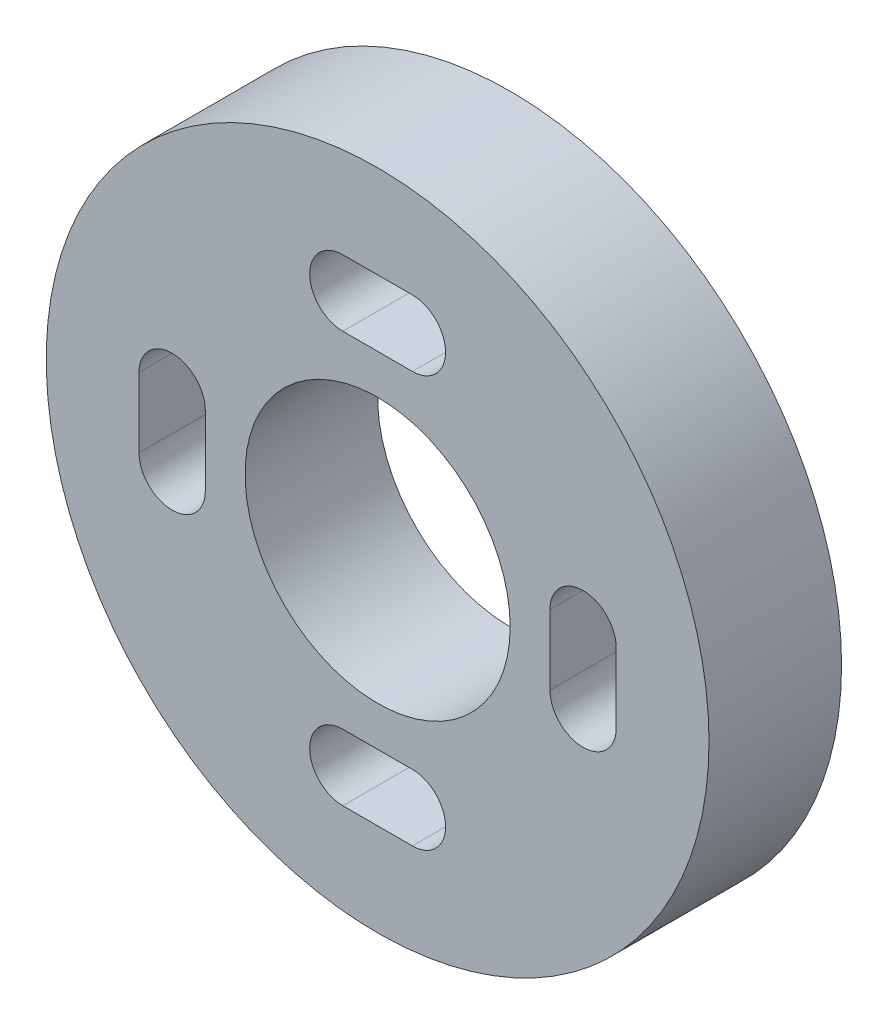
from build123d import *

# Parameters (mm, degrees)
SKETCH_1_R          = 10
EXTRUDE_1_DEPTH     = 4
SKETCH_2_R          = 4
CUT_EXTRUDE_1_DEPTH = 4


with BuildPart() as part:
    # 草圖1 → 填料-伸長1 (new body)
    with BuildSketch(Plane.XY):
        Circle(SKETCH_1_R)
    extrude(amount=EXTRUDE_1_DEPTH)

    # 草圖2 → 除料-伸長1 (cut)
    with BuildSketch(Plane.XY):
        Circle(SKETCH_2_R)
        with BuildLine():
            Line((-1.05, 7.2), (1.05, 7.2))
            ThreePointArc((1.05, 7.2), (2.05, 6.2), (1.05, 5.2))
            Line((1.05, 5.2), (-1.05, 5.2))
            ThreePointArc((-1.05, 5.2), (-2.05, 6.2), (-1.05, 7.2))
        make_face()
        with BuildLine():
            Line((-5.2, 1.05), (-5.2, -1.05))
            ThreePointArc((-5.2, -1.05), (-6.2, -2.05), (-7.2, -1.05))
            Line((-7.2, -1.05), (-7.2, 1.05))
            ThreePointArc((-7.2, 1.05), (-6.2, 2.05), (-5.2, 1.05))
        make_face()
        with BuildLine():
            Line((5.2, 1.05), (5.2, -1.05))
            ThreePointArc((5.2, -1.05), (6.2, -2.05), (7.2, -1.05))
            Line((7.2, -1.05), (7.2, 1.05))
            ThreePointArc((7.2, 1.05), (6.2, 2.05), (5.2, 1.05))
        make_face()
        with BuildLine():
            Line((-1.05, -7.2), (1.05, -7.2))
            ThreePointArc((1.05, -7.2), (2.05, -6.2), (1.05, -5.2))
            Line((1.05, -5.2), (-1.05, -5.2))
            ThreePointArc((-1.05, -5.2), (-2.05, -6.2), (-1.05, -7.2))
        make_face()
    extrude(amount=CUT_EXTRUDE_1_DEPTH, mode=Mode.SUBTRACT)


solid = part.part
